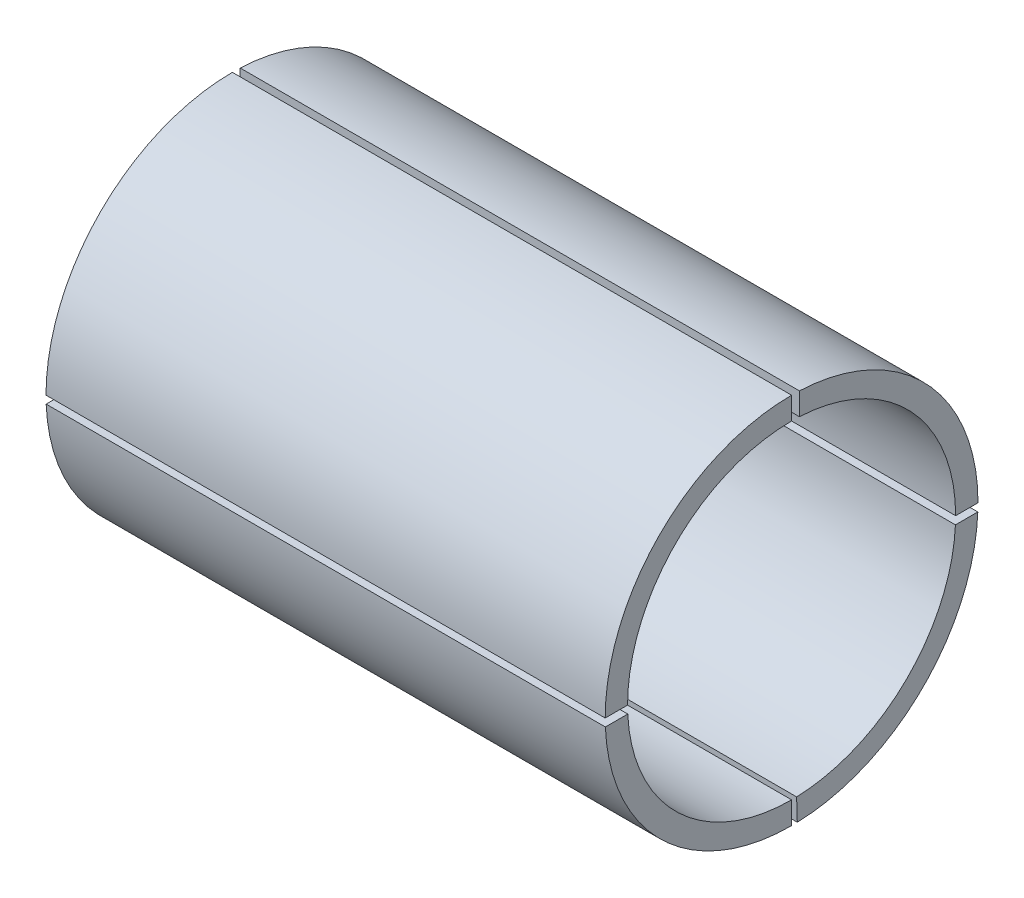
from build123d import *

# Parameters (mm, degrees)
BOSS_EXTRUDE1_DEPTH   = 15
BOSS_EXTRUDE1_2_DEPTH = 15
BOSS_EXTRUDE1_3_DEPTH = 15
BOSS_EXTRUDE1_4_DEPTH = 15


with BuildPart() as part:
    # Sketch2 → Boss-Extrude1 (new body)
    with BuildSketch(Plane(origin=(0, 0, 0), x_dir=(0, 0, -1), z_dir=(1, 0, 0))):
        with BuildLine():
            Line((-4.395015478, -0.209377526), (-4.995614182, -0.209377526))
            ThreePointArc((-4.995614182, -0.209377526), (-3.460716138, -3.608800883), (0, -5))
            Line((0, -5), (0, -4.4))
            ThreePointArc((0, -4.4), (-3.036341457, -3.184435673), (-4.395015478, -0.209377526))
        make_face()
    extrude(amount=BOSS_EXTRUDE1_DEPTH)


with BuildPart() as body_2:
    # Sketch2 → Boss-Extrude1 2 (new body)
    with BuildSketch(Plane(origin=(0, 0, 0), x_dir=(0, 0, -1), z_dir=(1, 0, 0))):
        with BuildLine():
            Line((-4.4, 0), (-5, 0))
            ThreePointArc((-5, 0), (-3.535533906, 3.535533906), (0, 5))
            Line((0, 5), (0, 4.4))
            ThreePointArc((0, 4.4), (-3.111269837, 3.111269837), (-4.4, 0))
        make_face()
    extrude(amount=BOSS_EXTRUDE1_2_DEPTH)


with BuildPart() as body_3:
    # Sketch2 → Boss-Extrude1 3 (new body)
    with BuildSketch(Plane(origin=(0, 0, 0), x_dir=(0, 0, -1), z_dir=(1, 0, 0))):
        with BuildLine():
            Line((0.209696333, 4.99560081), (0.209696333, 4.395000278))
            ThreePointArc((0.209696333, 4.395000278), (3.184545797, 3.036225958), (4.4, 0))
            Line((4.4, 0), (5, 0))
            ThreePointArc((5, 0), (3.608911308, 3.460600984), (0.209696333, 4.99560081))
        make_face()
    extrude(amount=BOSS_EXTRUDE1_3_DEPTH)


with BuildPart() as body_4:
    # Sketch2 → Boss-Extrude1 4 (new body)
    with BuildSketch(Plane(origin=(0, 0, 0), x_dir=(0, 0, -1), z_dir=(1, 0, 0))):
        with BuildLine():
            Line((4.395015478, -0.209377526), (4.995614182, -0.209377526))
            ThreePointArc((4.995614182, -0.209377526), (3.515442603, -3.55551168), (0.152748462, -4.997666246))
            Line((0.152748462, -4.997666246), (0.134418647, -4.397946297))
            ThreePointArc((0.134418647, -4.397946297), (3.084634575, -3.137679005), (4.395015478, -0.209377526))
        make_face()
    extrude(amount=BOSS_EXTRUDE1_4_DEPTH)


solid = Compound([part.part, body_2.part, body_3.part, body_4.part])
